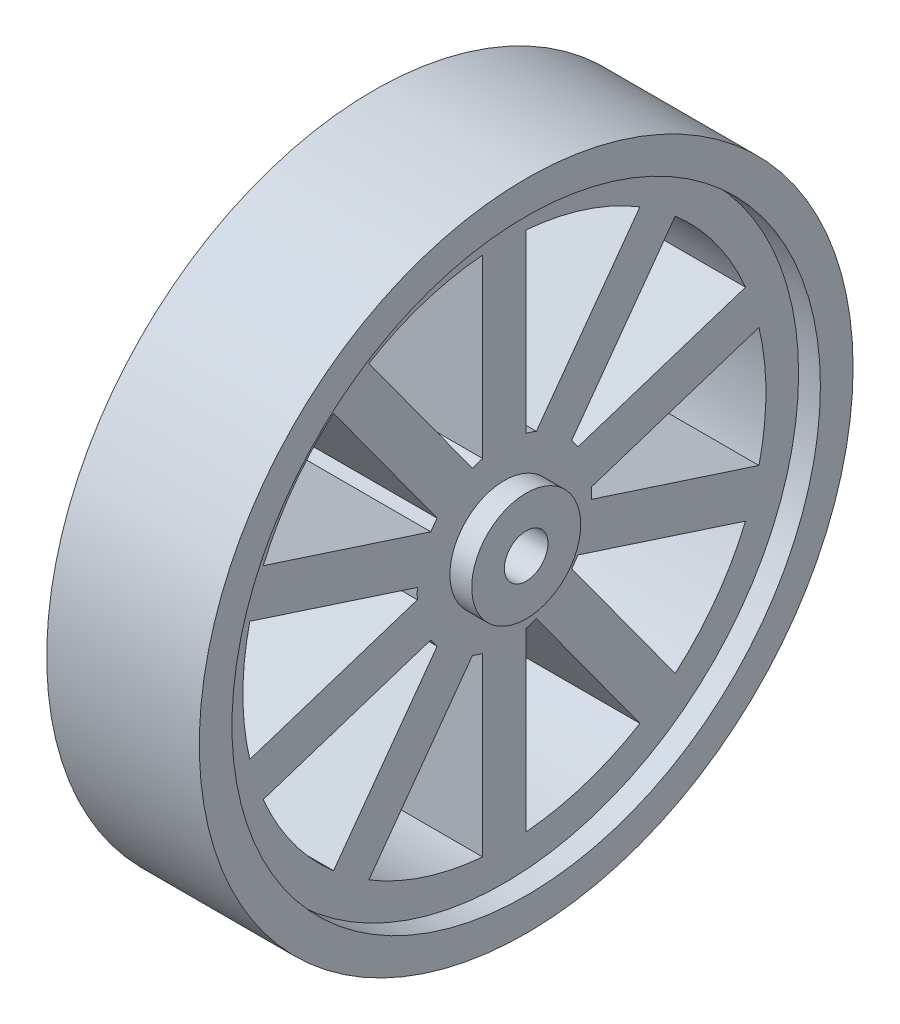
from build123d import *

# Parameters (mm, degrees)
SKETCH1_R               = 38.1
SKETCH1_R_2             = 2.54
BOSS_EXTRUDE1_DEPTH     = 8.89
CUT_EXTRUDE1_DEPTH      = 57.739302075
CUT_EXTRUDE1_DEPTH_BACK = 57.739302075
SKETCH3_R               = 34.29
SKETCH3_R_2             = 6.35
CUT_EXTRUDE2_DEPTH      = 2.54


with BuildPart() as part:
    # Sketch1 → Boss-Extrude1 (new, symmetric)
    with BuildSketch(Plane(origin=(0, 0, 0), x_dir=(0, 0, -1), z_dir=(1, 0, 0))):
        Circle(SKETCH1_R)
        Circle(SKETCH1_R_2, mode=Mode.SUBTRACT)
    extrude(amount=BOSS_EXTRUDE1_DEPTH, both=True)

    # Sketch2 → Cut-Extrude1 (cut, two sides: drawn at the far end of the back side and taken through both)
    with BuildSketch(Plane(origin=(8.89, 0, 0), x_dir=(0, 0, -1), z_dir=(1, 0, 0)).offset(-CUT_EXTRUDE1_DEPTH_BACK)):
        with BuildLine():
            Line((-2.54, 30.373982287), (-2.54, 9.837377699))
            ThreePointArc((-2.54, 9.837377699), (-3.139612663, 9.662734206), (-3.727362367, 9.45158028))
            Line((-3.727362367, 9.45158028), (-15.798475676, 26.066042398))
            ThreePointArc((-15.798475676, 26.066042398), (-9.418837989, 28.988202617), (-2.54, 30.373982287))
        make_face()
        with BuildLine():
            Line((2.54, 30.373982287), (2.54, 9.837377699))
            ThreePointArc((2.54, 9.837377699), (3.139612663, 9.662734206), (3.727362367, 9.45158028))
            Line((3.727362367, 9.45158028), (15.798475676, 26.066042398))
            ThreePointArc((15.798475676, 26.066042398), (9.418837989, 28.988202617), (2.54, 30.373982287))
        make_face()
        with BuildLine():
            Line((19.908282008, 23.080093317), (7.837168699, 6.465631198))
            ThreePointArc((7.837168699, 6.465631198), (8.219612663, 5.971898163), (8.570998999, 5.455600441))
            Line((8.570998999, 5.455600441), (28.102470615, 11.801760265))
            ThreePointArc((28.102470615, 11.801760265), (24.658837989, 17.91569449), (19.908282008, 23.080093317))
        make_face()
        with BuildLine():
            Line((29.672276946, 6.970393162), (10.14080533, 0.624233338))
            ThreePointArc((10.14080533, 0.624233338), (10.16, 0), (10.14080533, -0.624233338))
            Line((10.14080533, -0.624233338), (29.672276946, -6.970393162))
            ThreePointArc((29.672276946, -6.970393162), (30.48, 0), (29.672276946, 6.970393162))
        make_face()
        with BuildLine():
            Line((28.102470615, -11.801760265), (8.570998999, -5.455600441))
            ThreePointArc((8.570998999, -5.455600441), (8.219612663, -5.971898163), (7.837168699, -6.465631198))
            Line((7.837168699, -6.465631198), (19.908282008, -23.080093317))
            ThreePointArc((19.908282008, -23.080093317), (24.658837989, -17.91569449), (28.102470615, -11.801760265))
        make_face()
        with BuildLine():
            Line((15.798475676, -26.066042398), (3.727362367, -9.45158028))
            ThreePointArc((3.727362367, -9.45158028), (3.139612663, -9.662734206), (2.54, -9.837377699))
            Line((2.54, -9.837377699), (2.54, -30.373982287))
            ThreePointArc((2.54, -30.373982287), (9.418837989, -28.988202617), (15.798475676, -26.066042398))
        make_face()
        with BuildLine():
            Line((-2.54, -30.373982287), (-2.54, -9.837377699))
            ThreePointArc((-2.54, -9.837377699), (-3.139612663, -9.662734206), (-3.727362367, -9.45158028))
            Line((-3.727362367, -9.45158028), (-15.798475676, -26.066042398))
            ThreePointArc((-15.798475676, -26.066042398), (-9.418837989, -28.988202617), (-2.54, -30.373982287))
        make_face()
        with BuildLine():
            Line((-19.908282008, -23.080093317), (-7.837168699, -6.465631198))
            ThreePointArc((-7.837168699, -6.465631198), (-8.219612663, -5.971898163), (-8.570998999, -5.455600441))
            Line((-8.570998999, -5.455600441), (-28.102470615, -11.801760265))
            ThreePointArc((-28.102470615, -11.801760265), (-24.658837989, -17.91569449), (-19.908282008, -23.080093317))
        make_face()
        with BuildLine():
            Line((-29.672276946, -6.970393162), (-10.14080533, -0.624233338))
            ThreePointArc((-10.14080533, -0.624233338), (-10.16, 0), (-10.14080533, 0.624233338))
            Line((-10.14080533, 0.624233338), (-29.672276946, 6.970393162))
            ThreePointArc((-29.672276946, 6.970393162), (-30.48, 0), (-29.672276946, -6.970393162))
        make_face()
        with BuildLine():
            Line((-28.102470615, 11.801760265), (-8.570998999, 5.455600441))
            ThreePointArc((-8.570998999, 5.455600441), (-8.219612663, 5.971898163), (-7.837168699, 6.465631198))
            Line((-7.837168699, 6.465631198), (-19.908282008, 23.080093317))
            ThreePointArc((-19.908282008, 23.080093317), (-24.658837989, 17.91569449), (-28.102470615, 11.801760265))
        make_face()
    extrude(amount=CUT_EXTRUDE1_DEPTH + CUT_EXTRUDE1_DEPTH_BACK, mode=Mode.SUBTRACT)

    # Sketch3 → Cut-Extrude2 (cut)
    with BuildSketch(Plane(origin=(8.89, 0, 0), x_dir=(0, 0, -1), z_dir=(1, 0, 0))):
        Circle(SKETCH3_R)
        Circle(SKETCH3_R_2, mode=Mode.SUBTRACT)
    extrude(amount=-CUT_EXTRUDE2_DEPTH, mode=Mode.SUBTRACT)


solid = part.part
